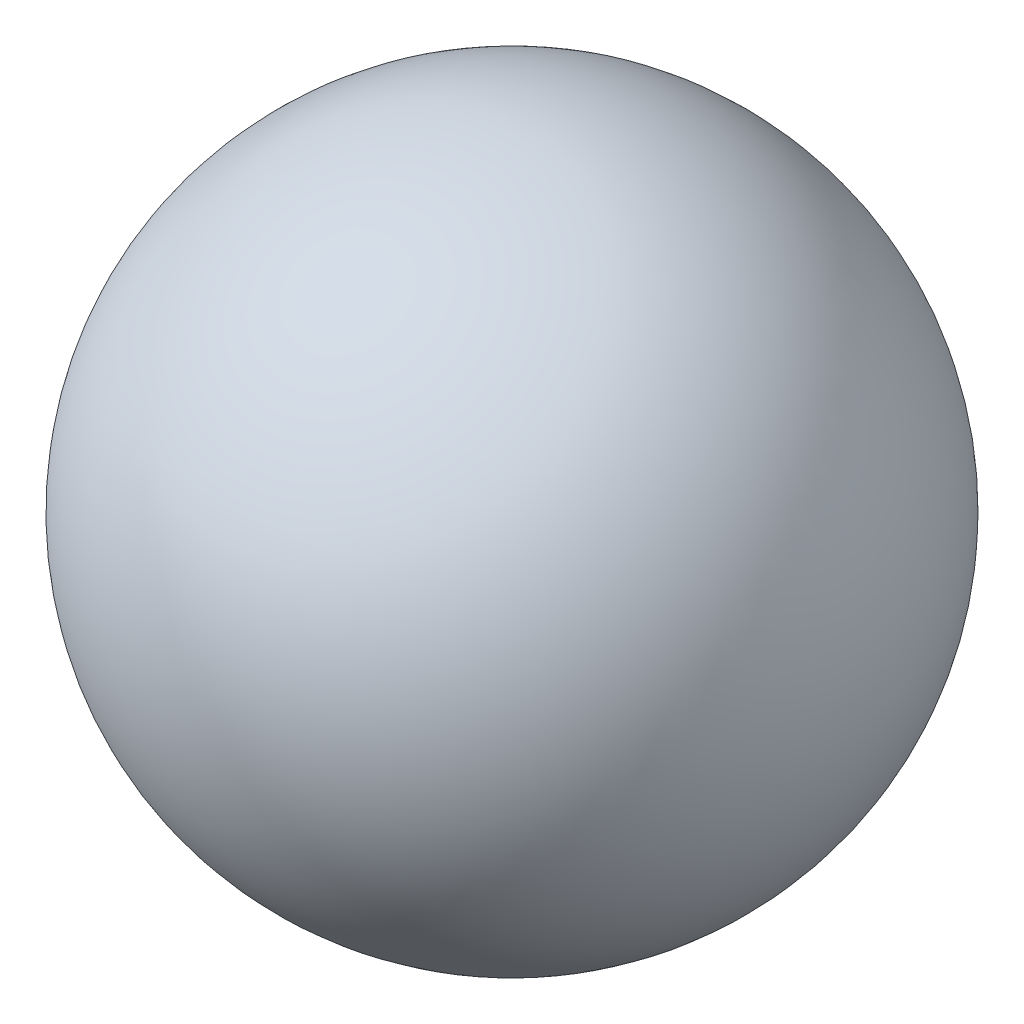
from build123d import *

# Parameters (mm, degrees)
CROQUIS2_W = 5
CROQUIS2_H = 60


with BuildPart() as part:
    # Croquis1 → Revolución1 (revolve)
    with BuildSketch(Plane.XY):
        with BuildLine():
            Line((0, -43.629252328), (0, 43.629252328))
            ThreePointArc((0, 43.629252328), (43.629252328, 0), (0, -43.629252328))
        make_face()
    revolve(axis=Axis((0, -43.629252328, 0), (0, 1, 0)))

    # Croquis2 → Cortar-Revolución1 (revolve, cut)
    with BuildSketch(Plane.XY, mode=Mode.PRIVATE) as cortar_revoluci_n1_sk:
        with Locations((2.5, -30)):
            Rectangle(CROQUIS2_W, CROQUIS2_H)
    revolve(cortar_revoluci_n1_sk.sketch.rotate(Axis((0, 0, 0), (0, -1, 0)), 180), axis=Axis((0, 0, 0), (0, -1, 0)), mode=Mode.SUBTRACT)


solid = part.part
